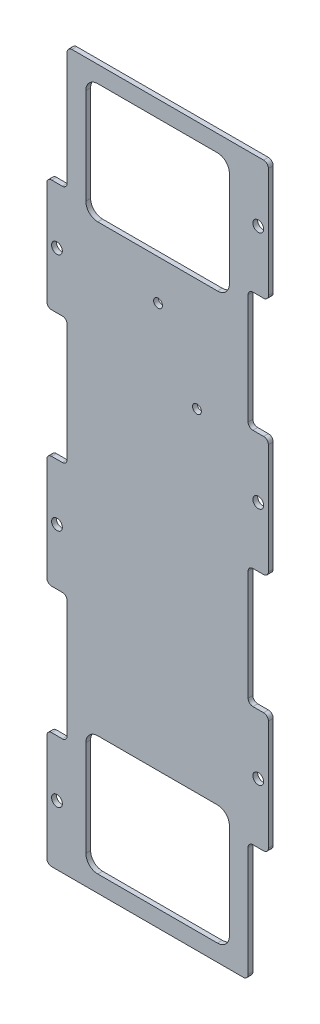
from build123d import *

# Parameters (mm, degrees)
SKETCH1_W           = 92.6
SKETCH1_H           = 300
BOSS_EXTRUDE1_DEPTH = 2
SKETCH2_R           = 2.25
SKETCH2_W           = 8.48
SKETCH2_H           = 51.5
SKETCH2_H_2         = 50
SKETCH2_H_3         = 53
CUT_EXTRUDE1_DEPTH  = 10
FILLET1_R           = 2
CUT_EXTRUDE3_DEPTH  = 8.5
SKETCH5_R           = 1.85
CUT_EXTRUDE4_DEPTH  = 10


with BuildPart() as part:
    # Sketch1 → Boss-Extrude1 (new body)
    with BuildSketch(Plane.XY):
        Rectangle(SKETCH1_W, SKETCH1_H)
    extrude(amount=BOSS_EXTRUDE1_DEPTH)

    # Sketch2 → Cut-Extrude1 (cut)
    with BuildSketch(Plane.XY):
        with Locations((-42.06, 75)):
            Circle(SKETCH2_R)
        with Locations((42.06, 125)):
            Circle(SKETCH2_R)
        with Locations((42.06, 25)):
            Circle(SKETCH2_R)
        with Locations((42.06, -75)):
            Circle(SKETCH2_R)
        with Locations((-42.06, -25)):
            Circle(SKETCH2_R)
        with Locations((-42.06, -125)):
            Circle(SKETCH2_R)
        with Locations((-42.06, 124.25)):
            Rectangle(SKETCH2_W, SKETCH2_H)
        with Locations((42.06, 75)):
            Rectangle(SKETCH2_W, SKETCH2_H_2)
        with Locations((42.06, -25)):
            Rectangle(SKETCH2_W, SKETCH2_H_2)
        with Locations((-42.06, 25)):
            Rectangle(SKETCH2_W, SKETCH2_H_3)
        with Locations((-42.06, -75)):
            Rectangle(SKETCH2_W, SKETCH2_H_3)
        with Locations((42.06, -125)):
            Rectangle(SKETCH2_W, SKETCH2_H_2)
    extrude(amount=CUT_EXTRUDE1_DEPTH, mode=Mode.SUBTRACT)

    # Fillet1
    fillet1_edges = [part.edges().sort_by_distance(p)[0] for p in [
        (46.3, -100, 1),
        (37.82, -100, 1),
        (37.82, -150, 1),
        (46.3, 50, 1),
        (46.3, 100, 1),
        (37.82, 100, 1),
        (37.82, 50, 1),
        (-46.3, -48.5, 1),
        (-46.3, -101.5, 1),
        (-37.82, -101.5, 1),
        (-37.82, -48.5, 1),
        (37.82, 0, 1),
        (37.82, -50, 1),
        (46.3, -50, 1),
        (46.3, 0, 1),
        (46.3, 150, 1),
        (-46.3, -150, 1),
        (-46.3, 51.5, 1),
        (-46.3, -1.5, 1),
        (-37.82, -1.5, 1),
        (-37.82, 51.5, 1),
        (-46.3, 98.5, 1),
        (-37.82, 98.5, 1),
        (-37.82, 150, 1),
    ]]
    fillet(fillet1_edges, radius=FILLET1_R)

    # Sketch4 → Cut-Extrude3 (cut)
    with BuildSketch(Plane(origin=(0, 0, 0), x_dir=(-1, 0, 0), z_dir=(0, 0, -1))):
        with BuildLine():
            Line((25, 93), (-25, 93))
            ThreePointArc((-25, 93), (-28.535533906, 94.464466094), (-30, 98))
            Line((-30, 98), (-30, 138))
            ThreePointArc((-30, 138), (-28.535533906, 141.535533906), (-25, 143))
            Line((-25, 143), (25, 143))
            ThreePointArc((25, 143), (28.535533906, 141.535533906), (30, 138))
            Line((30, 138), (30, 98))
            ThreePointArc((30, 98), (28.535533906, 94.464466094), (25, 93))
        make_face()
        with BuildLine():
            Line((25, -143), (-25, -143))
            ThreePointArc((-25, -143), (-28.535533906, -141.535533906), (-30, -138))
            Line((-30, -138), (-30, -98))
            ThreePointArc((-30, -98), (-28.535533906, -94.464466094), (-25, -93))
            Line((-25, -93), (25, -93))
            ThreePointArc((25, -93), (28.535533906, -94.464466094), (30, -98))
            Line((30, -98), (30, -138))
            ThreePointArc((30, -138), (28.535533906, -141.535533906), (25, -143))
        make_face()
    extrude(amount=-CUT_EXTRUDE3_DEPTH, mode=Mode.SUBTRACT)

    # Sketch5 → Cut-Extrude4 (cut)
    with BuildSketch(Plane(origin=(0, 0, 0), x_dir=(-1, 0, 0), z_dir=(0, 0, -1))):
        with Locations((-16.43, 46)):
            Circle(SKETCH5_R)
        with Locations((-0.18, 76.2)):
            Circle(SKETCH5_R)
    extrude(amount=-CUT_EXTRUDE4_DEPTH, mode=Mode.SUBTRACT)


solid = part.part
